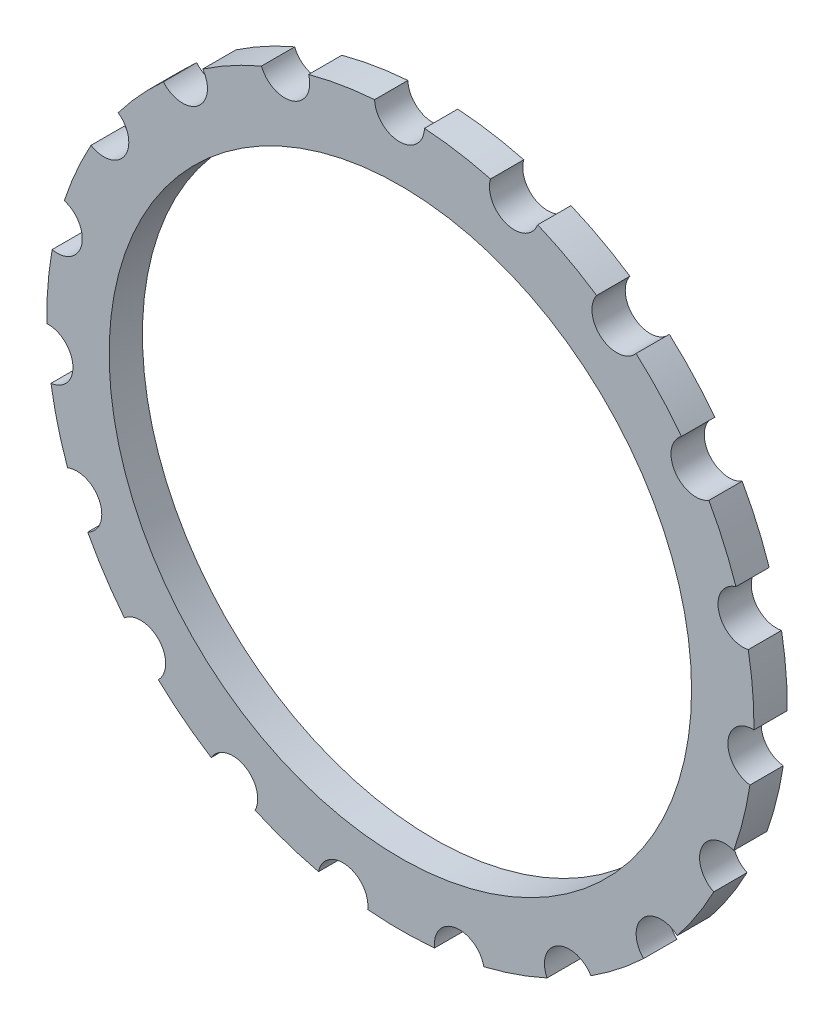
from build123d import *

# Parameters (mm, degrees)
SKETCH2_R           = 8.5
SKETCH2_R_2         = 7
BOSS_EXTRUDE1_DEPTH = 0.8
CUT_EXTRUDE1_DEPTH  = 13.04740636
CIRPATTERN2_COUNT   = 19


with BuildPart() as part:
    # Sketch2 → Boss-Extrude1 (new body)
    with BuildSketch(Plane.XY):
        Circle(SKETCH2_R)
        Circle(SKETCH2_R_2, mode=Mode.SUBTRACT)
    extrude(amount=BOSS_EXTRUDE1_DEPTH)

    # Sketch3 → Cut-Extrude1 (cut, symmetric)
    with BuildSketch(Plane.XY):
        with BuildLine():
            Line((21.193331558, 54.843524577), (3.301793839, 7.83250646))
            ThreePointArc((3.301793839, 7.83250646), (2.547786774, 7.478098476), (2.166996346, 8.219131757))
            Line((2.166996346, 8.219131757), (16.698741556, 56.374830563))
            Line((16.698741556, 56.374830563), (49.142224258, 151.600836547))
            Line((49.142224258, 151.600836547), (53.63681426, 150.069530561))
            Line((53.63681426, 150.069530561), (21.193331558, 54.843524577))
        make_face()
    cut_extrude1 = extrude(amount=CUT_EXTRUDE1_DEPTH, both=True, mode=Mode.SUBTRACT)

    # CirPattern2: Cut-Extrude1 ×19 about axis
    cirpattern2_axis = Axis((0, 0, 0), (0, 0, 1))
    for i in range(1, CIRPATTERN2_COUNT):
        add(cut_extrude1.rotate(cirpattern2_axis, i * 360 / CIRPATTERN2_COUNT), mode=Mode.SUBTRACT)


solid = part.part
